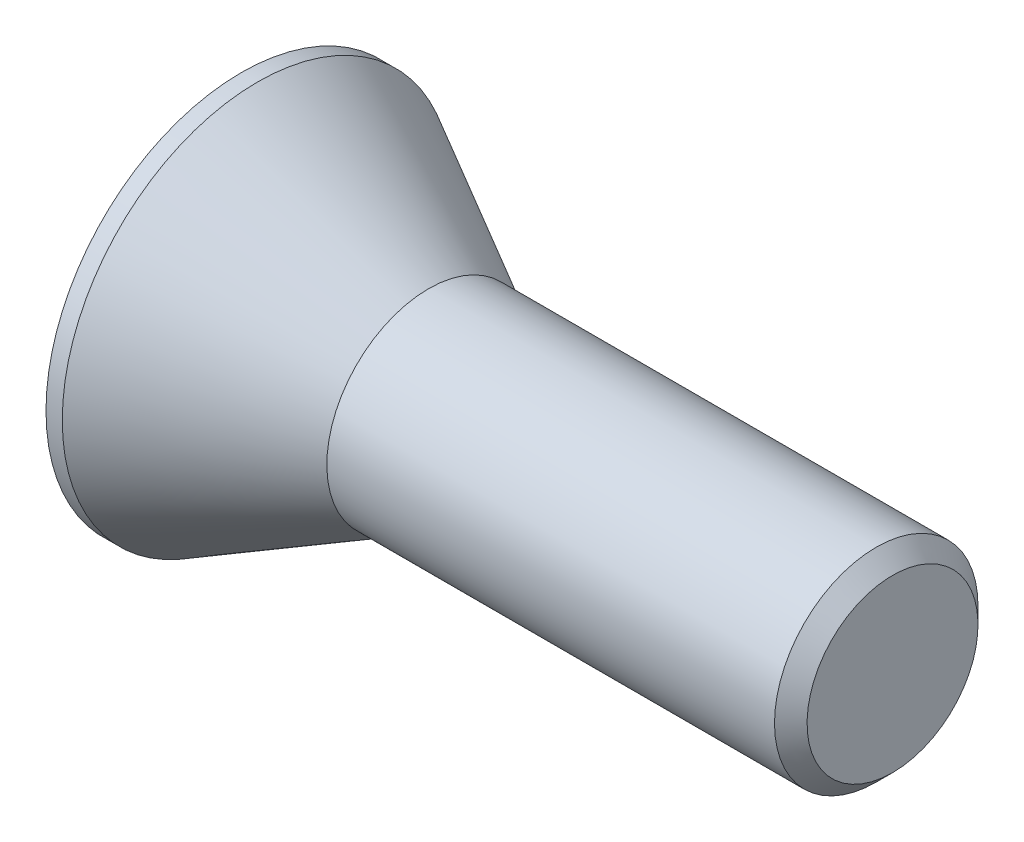
from build123d import *

# Parameters (mm, degrees)
CUT_EXTRUDE_1_DEPTH = 0.4
CHAMFER_1_SIZE      = 0.2


with BuildPart() as part:
    # 草图1 → 旋转1 (revolve)
    with BuildSketch(Plane.XY, mode=Mode.PRIVATE) as revolve_1_sk:
        Polygon((0, 0), (0, -2.4), (0.2, -2.4), (2.3, -1.25), (8, -1.25), (8, 0), align=None)
    revolve(revolve_1_sk.sketch.rotate(Axis((8, 0, 0), (-1, 0, 0)), 180), axis=Axis((8, 0, 0), (-1, 0, 0)))

    # 草图2 → 切除-拉伸1 (cut)
    with BuildSketch(Plane.ZY):
        Polygon((0.866025404, 0), (0.433012702, 0.75), (-0.433012702, 0.75), (-0.866025404, 0), (-0.433012702, -0.75), (0.433012702, -0.75), align=None)
    extrude(amount=-CUT_EXTRUDE_1_DEPTH, mode=Mode.SUBTRACT)

    # 倒角1
    chamfer_1_edges = [part.edges().sort_by_distance(p)[0] for p in [
        (8, -1.25, 0),
    ]]
    chamfer(chamfer_1_edges, length=CHAMFER_1_SIZE)


solid = part.part
